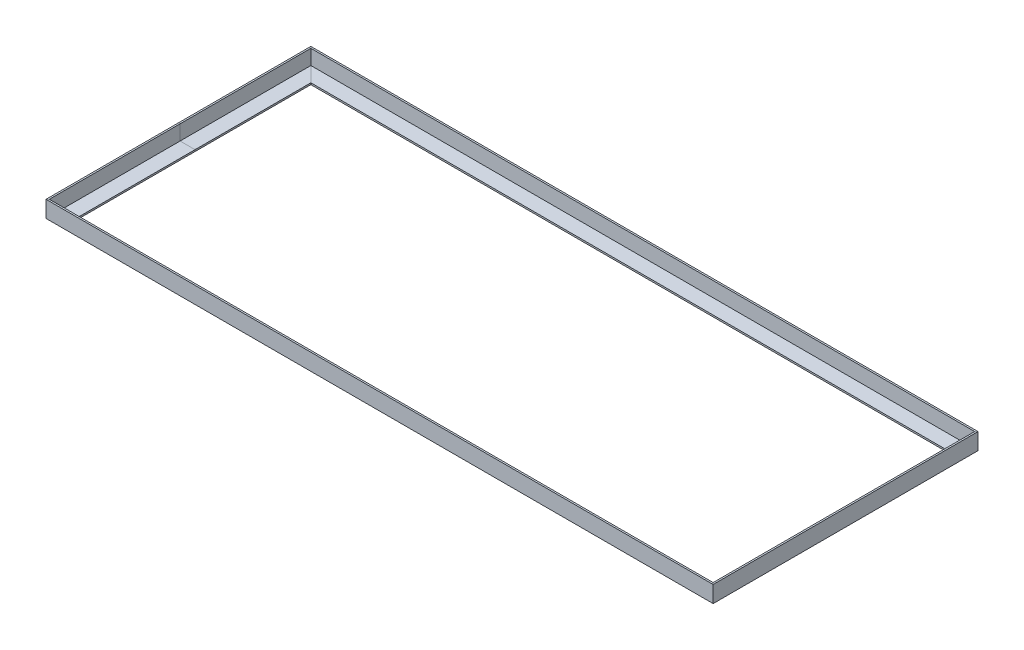
from build123d import *


with BuildPart() as part:
    # Sweep1: sweep along a path in Sketch2
    with BuildLine(Plane(origin=(0, 0, 0), x_dir=(1, 0, 0), z_dir=(0, 1, 0))) as sweep1_path:
        Line((-1005, -399), (1005, -399))
        Line((1005, -399), (1005, 399))
        Line((1005, 399), (-1005, 399))
        Line((-1005, 399), (-1005, -399))
    # Sketch3 → Sweep1 (sweep)
    with BuildSketch(Plane.XY):
        Polygon((-955, 0), (-1005, 0), (-1005, 50), (-1000, 50), (-1000, 5), (-955, 5), align=None)
    sweep(path=sweep1_path.line, transition=Transition.RIGHT)


solid = part.part
